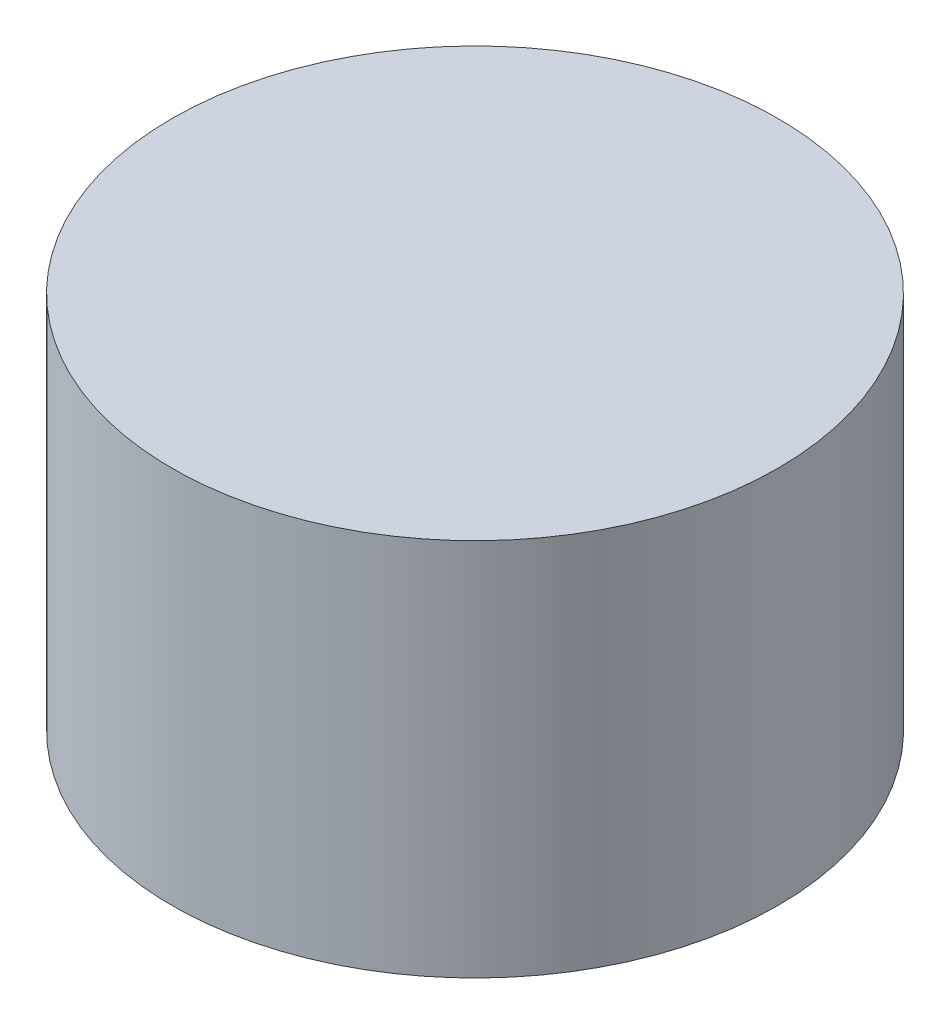
from build123d import *


with BuildPart() as part:
    # Sketch1 → Revolve1 (revolve)
    with BuildSketch(Plane.XY, mode=Mode.PRIVATE) as revolve1_sk:
        with BuildLine():
            Line((20, 25), (20, 0))
            Line((20, 0), (18.5, 0))
            ThreePointArc((18.5, 0), (17.5, 1), (16.5, 0))
            Line((16.5, 0), (15, 0))
            add(Edge.make_bspline(
                [(0, 20), (15, 20), (15, 0)],
                knots=[0, 0, 0, 1, 1, 1], degree=2, weights=[1, 0.428571429, 1]))
            Line((0, 20), (0, 25))
            Line((0, 25), (20, 25))
        make_face()
    revolve(revolve1_sk.sketch.rotate(Axis((0, 20, 0), (0, -1, 0)), 180), axis=Axis((0, 20, 0), (0, -1, 0)))


solid = part.part
